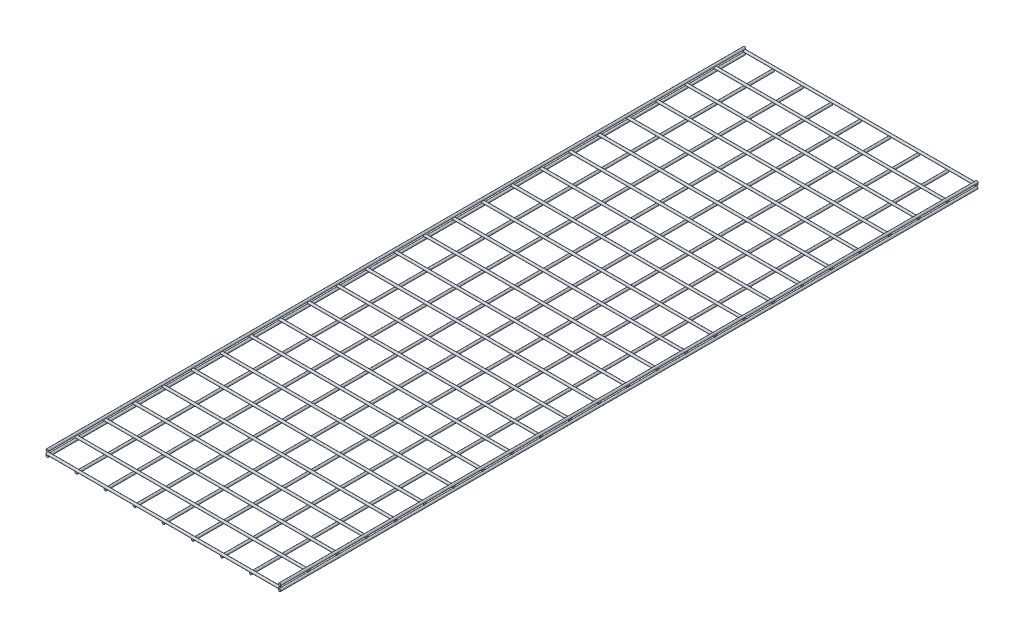
from build123d import *

# Parameters (mm, degrees)
SKETCH1_R              = 3.175
BOSS_EXTRUDE1_DEPTH    = 1828.8
BOSS_EXTRUDE1_2_DEPTH  = 1828.8
BOSS_EXTRUDE1_3_DEPTH  = 1828.8
BOSS_EXTRUDE1_4_DEPTH  = 1828.8
BOSS_EXTRUDE1_5_DEPTH  = 1828.8
BOSS_EXTRUDE1_6_DEPTH  = 1828.8
BOSS_EXTRUDE1_7_DEPTH  = 1828.8
BOSS_EXTRUDE1_8_DEPTH  = 1828.8
BOSS_EXTRUDE1_9_DEPTH  = 1828.8
BOSS_EXTRUDE1_10_DEPTH = 1828.8
BOSS_EXTRUDE1_11_DEPTH = 1828.8
SKETCH2_R              = 3.175
BOSS_EXTRUDE2_DEPTH    = 609.6
BOSS_EXTRUDE2_2_DEPTH  = 609.6
BOSS_EXTRUDE2_3_DEPTH  = 609.6
BOSS_EXTRUDE2_4_DEPTH  = 609.6
BOSS_EXTRUDE2_5_DEPTH  = 609.6
BOSS_EXTRUDE2_6_DEPTH  = 609.6
BOSS_EXTRUDE2_7_DEPTH  = 609.6
BOSS_EXTRUDE2_8_DEPTH  = 609.6
BOSS_EXTRUDE2_9_DEPTH  = 609.6
BOSS_EXTRUDE2_10_DEPTH = 609.6
BOSS_EXTRUDE2_11_DEPTH = 609.6
BOSS_EXTRUDE2_12_DEPTH = 609.6
BOSS_EXTRUDE2_13_DEPTH = 609.6
BOSS_EXTRUDE2_14_DEPTH = 609.6
BOSS_EXTRUDE2_15_DEPTH = 609.6
BOSS_EXTRUDE2_16_DEPTH = 609.6
BOSS_EXTRUDE2_17_DEPTH = 609.6
BOSS_EXTRUDE2_18_DEPTH = 609.6
BOSS_EXTRUDE2_19_DEPTH = 609.6
BOSS_EXTRUDE2_20_DEPTH = 609.6
BOSS_EXTRUDE2_21_DEPTH = 609.6
BOSS_EXTRUDE2_22_DEPTH = 609.6
BOSS_EXTRUDE2_23_DEPTH = 609.6
BOSS_EXTRUDE2_24_DEPTH = 609.6
BOSS_EXTRUDE2_25_DEPTH = 609.6


with BuildPart() as part:
    # Sketch1 → Boss-Extrude1 (new body)
    with BuildSketch(Plane.XY):
        Circle(SKETCH1_R)
    extrude(amount=BOSS_EXTRUDE1_DEPTH)


with BuildPart() as body_2:
    # Sketch1 → Boss-Extrude1 2 (new body)
    with BuildSketch(Plane.XY):
        with Locations((0, 12.7)):
            Circle(SKETCH1_R)
    extrude(amount=BOSS_EXTRUDE1_2_DEPTH)


with BuildPart() as body_3:
    # Sketch1 → Boss-Extrude1 3 (new body)
    with BuildSketch(Plane.XY):
        with Locations((76.2, 0)):
            Circle(SKETCH1_R)
    extrude(amount=BOSS_EXTRUDE1_3_DEPTH)


with BuildPart() as body_4:
    # Sketch1 → Boss-Extrude1 4 (new body)
    with BuildSketch(Plane.XY):
        with Locations((152.4, 0)):
            Circle(SKETCH1_R)
    extrude(amount=BOSS_EXTRUDE1_4_DEPTH)


with BuildPart() as body_5:
    # Sketch1 → Boss-Extrude1 5 (new body)
    with BuildSketch(Plane.XY):
        with Locations((228.6, 0)):
            Circle(SKETCH1_R)
    extrude(amount=BOSS_EXTRUDE1_5_DEPTH)


with BuildPart() as body_6:
    # Sketch1 → Boss-Extrude1 6 (new body)
    with BuildSketch(Plane.XY):
        with Locations((304.8, 0)):
            Circle(SKETCH1_R)
    extrude(amount=BOSS_EXTRUDE1_6_DEPTH)


with BuildPart() as body_7:
    # Sketch1 → Boss-Extrude1 7 (new body)
    with BuildSketch(Plane.XY):
        with Locations((381, 0)):
            Circle(SKETCH1_R)
    extrude(amount=BOSS_EXTRUDE1_7_DEPTH)


with BuildPart() as body_8:
    # Sketch1 → Boss-Extrude1 8 (new body)
    with BuildSketch(Plane.XY):
        with Locations((457.2, 0)):
            Circle(SKETCH1_R)
    extrude(amount=BOSS_EXTRUDE1_8_DEPTH)


with BuildPart() as body_9:
    # Sketch1 → Boss-Extrude1 9 (new body)
    with BuildSketch(Plane.XY):
        with Locations((533.4, 0)):
            Circle(SKETCH1_R)
    extrude(amount=BOSS_EXTRUDE1_9_DEPTH)


with BuildPart() as body_10:
    # Sketch1 → Boss-Extrude1 10 (new body)
    with BuildSketch(Plane.XY):
        with Locations((609.6, 0)):
            Circle(SKETCH1_R)
    extrude(amount=BOSS_EXTRUDE1_10_DEPTH)


with BuildPart() as body_11:
    # Sketch1 → Boss-Extrude1 11 (new body)
    with BuildSketch(Plane.XY):
        with Locations((609.6, 12.7)):
            Circle(SKETCH1_R)
    extrude(amount=BOSS_EXTRUDE1_11_DEPTH)


with BuildPart() as body_12:
    # Sketch2 → Boss-Extrude2 (new body)
    with BuildSketch(Plane(origin=(0, 0, 0), x_dir=(0, 0, -1), z_dir=(1, 0, 0))):
        with Locations(Location((0, 6.35, 0), (0, 0, 180))):
            Circle(SKETCH2_R)
    extrude(amount=BOSS_EXTRUDE2_DEPTH)


with BuildPart() as body_13:
    # Sketch2 → Boss-Extrude2 2 (new body)
    with BuildSketch(Plane(origin=(0, 0, 0), x_dir=(0, 0, -1), z_dir=(1, 0, 0))):
        with Locations(Location((-76.2, 6.35, 0), (0, 0, 180))):
            Circle(SKETCH2_R)
    extrude(amount=BOSS_EXTRUDE2_2_DEPTH)


with BuildPart() as body_14:
    # Sketch2 → Boss-Extrude2 3 (new body)
    with BuildSketch(Plane(origin=(0, 0, 0), x_dir=(0, 0, -1), z_dir=(1, 0, 0))):
        with Locations(Location((-152.4, 6.35, 0), (0, 0, 180))):
            Circle(SKETCH2_R)
    extrude(amount=BOSS_EXTRUDE2_3_DEPTH)


with BuildPart() as body_15:
    # Sketch2 → Boss-Extrude2 4 (new body)
    with BuildSketch(Plane(origin=(0, 0, 0), x_dir=(0, 0, -1), z_dir=(1, 0, 0))):
        with Locations(Location((-228.6, 6.35, 0), (0, 0, 180))):
            Circle(SKETCH2_R)
    extrude(amount=BOSS_EXTRUDE2_4_DEPTH)


with BuildPart() as body_16:
    # Sketch2 → Boss-Extrude2 5 (new body)
    with BuildSketch(Plane(origin=(0, 0, 0), x_dir=(0, 0, -1), z_dir=(1, 0, 0))):
        with Locations(Location((-304.8, 6.35, 0), (0, 0, 180))):
            Circle(SKETCH2_R)
    extrude(amount=BOSS_EXTRUDE2_5_DEPTH)


with BuildPart() as body_17:
    # Sketch2 → Boss-Extrude2 6 (new body)
    with BuildSketch(Plane(origin=(0, 0, 0), x_dir=(0, 0, -1), z_dir=(1, 0, 0))):
        with Locations(Location((-381, 6.35, 0), (0, 0, 180))):
            Circle(SKETCH2_R)
    extrude(amount=BOSS_EXTRUDE2_6_DEPTH)


with BuildPart() as body_18:
    # Sketch2 → Boss-Extrude2 7 (new body)
    with BuildSketch(Plane(origin=(0, 0, 0), x_dir=(0, 0, -1), z_dir=(1, 0, 0))):
        with Locations(Location((-457.2, 6.35, 0), (0, 0, 180))):
            Circle(SKETCH2_R)
    extrude(amount=BOSS_EXTRUDE2_7_DEPTH)


with BuildPart() as body_19:
    # Sketch2 → Boss-Extrude2 8 (new body)
    with BuildSketch(Plane(origin=(0, 0, 0), x_dir=(0, 0, -1), z_dir=(1, 0, 0))):
        with Locations(Location((-533.4, 6.35, 0), (0, 0, 180))):
            Circle(SKETCH2_R)
    extrude(amount=BOSS_EXTRUDE2_8_DEPTH)


with BuildPart() as body_20:
    # Sketch2 → Boss-Extrude2 9 (new body)
    with BuildSketch(Plane(origin=(0, 0, 0), x_dir=(0, 0, -1), z_dir=(1, 0, 0))):
        with Locations(Location((-609.6, 6.35, 0), (0, 0, 180))):
            Circle(SKETCH2_R)
    extrude(amount=BOSS_EXTRUDE2_9_DEPTH)


with BuildPart() as body_21:
    # Sketch2 → Boss-Extrude2 10 (new body)
    with BuildSketch(Plane(origin=(0, 0, 0), x_dir=(0, 0, -1), z_dir=(1, 0, 0))):
        with Locations(Location((-685.8, 6.35, 0), (0, 0, 180))):
            Circle(SKETCH2_R)
    extrude(amount=BOSS_EXTRUDE2_10_DEPTH)


with BuildPart() as body_22:
    # Sketch2 → Boss-Extrude2 11 (new body)
    with BuildSketch(Plane(origin=(0, 0, 0), x_dir=(0, 0, -1), z_dir=(1, 0, 0))):
        with Locations(Location((-762, 6.35, 0), (0, 0, 180))):
            Circle(SKETCH2_R)
    extrude(amount=BOSS_EXTRUDE2_11_DEPTH)


with BuildPart() as body_23:
    # Sketch2 → Boss-Extrude2 12 (new body)
    with BuildSketch(Plane(origin=(0, 0, 0), x_dir=(0, 0, -1), z_dir=(1, 0, 0))):
        with Locations(Location((-838.2, 6.35, 0), (0, 0, 180))):
            Circle(SKETCH2_R)
    extrude(amount=BOSS_EXTRUDE2_12_DEPTH)


with BuildPart() as body_24:
    # Sketch2 → Boss-Extrude2 13 (new body)
    with BuildSketch(Plane(origin=(0, 0, 0), x_dir=(0, 0, -1), z_dir=(1, 0, 0))):
        with Locations(Location((-914.4, 6.35, 0), (0, 0, 180))):
            Circle(SKETCH2_R)
    extrude(amount=BOSS_EXTRUDE2_13_DEPTH)


with BuildPart() as body_25:
    # Sketch2 → Boss-Extrude2 14 (new body)
    with BuildSketch(Plane(origin=(0, 0, 0), x_dir=(0, 0, -1), z_dir=(1, 0, 0))):
        with Locations(Location((-990.6, 6.35, 0), (0, 0, 180))):
            Circle(SKETCH2_R)
    extrude(amount=BOSS_EXTRUDE2_14_DEPTH)


with BuildPart() as body_26:
    # Sketch2 → Boss-Extrude2 15 (new body)
    with BuildSketch(Plane(origin=(0, 0, 0), x_dir=(0, 0, -1), z_dir=(1, 0, 0))):
        with Locations(Location((-1066.8, 6.35, 0), (0, 0, 180))):
            Circle(SKETCH2_R)
    extrude(amount=BOSS_EXTRUDE2_15_DEPTH)


with BuildPart() as body_27:
    # Sketch2 → Boss-Extrude2 16 (new body)
    with BuildSketch(Plane(origin=(0, 0, 0), x_dir=(0, 0, -1), z_dir=(1, 0, 0))):
        with Locations(Location((-1143, 6.35, 0), (0, 0, 180))):
            Circle(SKETCH2_R)
    extrude(amount=BOSS_EXTRUDE2_16_DEPTH)


with BuildPart() as body_28:
    # Sketch2 → Boss-Extrude2 17 (new body)
    with BuildSketch(Plane(origin=(0, 0, 0), x_dir=(0, 0, -1), z_dir=(1, 0, 0))):
        with Locations(Location((-1219.2, 6.35, 0), (0, 0, 180))):
            Circle(SKETCH2_R)
    extrude(amount=BOSS_EXTRUDE2_17_DEPTH)


with BuildPart() as body_29:
    # Sketch2 → Boss-Extrude2 18 (new body)
    with BuildSketch(Plane(origin=(0, 0, 0), x_dir=(0, 0, -1), z_dir=(1, 0, 0))):
        with Locations(Location((-1295.4, 6.35, 0), (0, 0, 180))):
            Circle(SKETCH2_R)
    extrude(amount=BOSS_EXTRUDE2_18_DEPTH)


with BuildPart() as body_30:
    # Sketch2 → Boss-Extrude2 19 (new body)
    with BuildSketch(Plane(origin=(0, 0, 0), x_dir=(0, 0, -1), z_dir=(1, 0, 0))):
        with Locations(Location((-1371.6, 6.35, 0), (0, 0, 180))):
            Circle(SKETCH2_R)
    extrude(amount=BOSS_EXTRUDE2_19_DEPTH)


with BuildPart() as body_31:
    # Sketch2 → Boss-Extrude2 20 (new body)
    with BuildSketch(Plane(origin=(0, 0, 0), x_dir=(0, 0, -1), z_dir=(1, 0, 0))):
        with Locations(Location((-1447.8, 6.35, 0), (0, 0, 180))):
            Circle(SKETCH2_R)
    extrude(amount=BOSS_EXTRUDE2_20_DEPTH)


with BuildPart() as body_32:
    # Sketch2 → Boss-Extrude2 21 (new body)
    with BuildSketch(Plane(origin=(0, 0, 0), x_dir=(0, 0, -1), z_dir=(1, 0, 0))):
        with Locations(Location((-1524, 6.35, 0), (0, 0, 180))):
            Circle(SKETCH2_R)
    extrude(amount=BOSS_EXTRUDE2_21_DEPTH)


with BuildPart() as body_33:
    # Sketch2 → Boss-Extrude2 22 (new body)
    with BuildSketch(Plane(origin=(0, 0, 0), x_dir=(0, 0, -1), z_dir=(1, 0, 0))):
        with Locations(Location((-1600.2, 6.35, 0), (0, 0, 180))):
            Circle(SKETCH2_R)
    extrude(amount=BOSS_EXTRUDE2_22_DEPTH)


with BuildPart() as body_34:
    # Sketch2 → Boss-Extrude2 23 (new body)
    with BuildSketch(Plane(origin=(0, 0, 0), x_dir=(0, 0, -1), z_dir=(1, 0, 0))):
        with Locations(Location((-1676.4, 6.35, 0), (0, 0, 180))):
            Circle(SKETCH2_R)
    extrude(amount=BOSS_EXTRUDE2_23_DEPTH)


with BuildPart() as body_35:
    # Sketch2 → Boss-Extrude2 24 (new body)
    with BuildSketch(Plane(origin=(0, 0, 0), x_dir=(0, 0, -1), z_dir=(1, 0, 0))):
        with Locations(Location((-1752.6, 6.35, 0), (0, 0, 180))):
            Circle(SKETCH2_R)
    extrude(amount=BOSS_EXTRUDE2_24_DEPTH)


with BuildPart() as body_36:
    # Sketch2 → Boss-Extrude2 25 (new body)
    with BuildSketch(Plane(origin=(0, 0, 0), x_dir=(0, 0, -1), z_dir=(1, 0, 0))):
        with Locations(Location((-1828.8, 6.35, 0), (0, 0, 180))):
            Circle(SKETCH2_R)
    extrude(amount=BOSS_EXTRUDE2_25_DEPTH)


solid = Compound([part.part, body_2.part, body_3.part, body_4.part, body_5.part, body_6.part, body_7.part, body_8.part, body_9.part, body_10.part, body_11.part, body_12.part, body_13.part, body_14.part, body_15.part, body_16.part, body_17.part, body_18.part, body_19.part, body_20.part, body_21.part, body_22.part, body_23.part, body_24.part, body_25.part, body_26.part, body_27.part, body_28.part, body_29.part, body_30.part, body_31.part, body_32.part, body_33.part, body_34.part, body_35.part, body_36.part])
